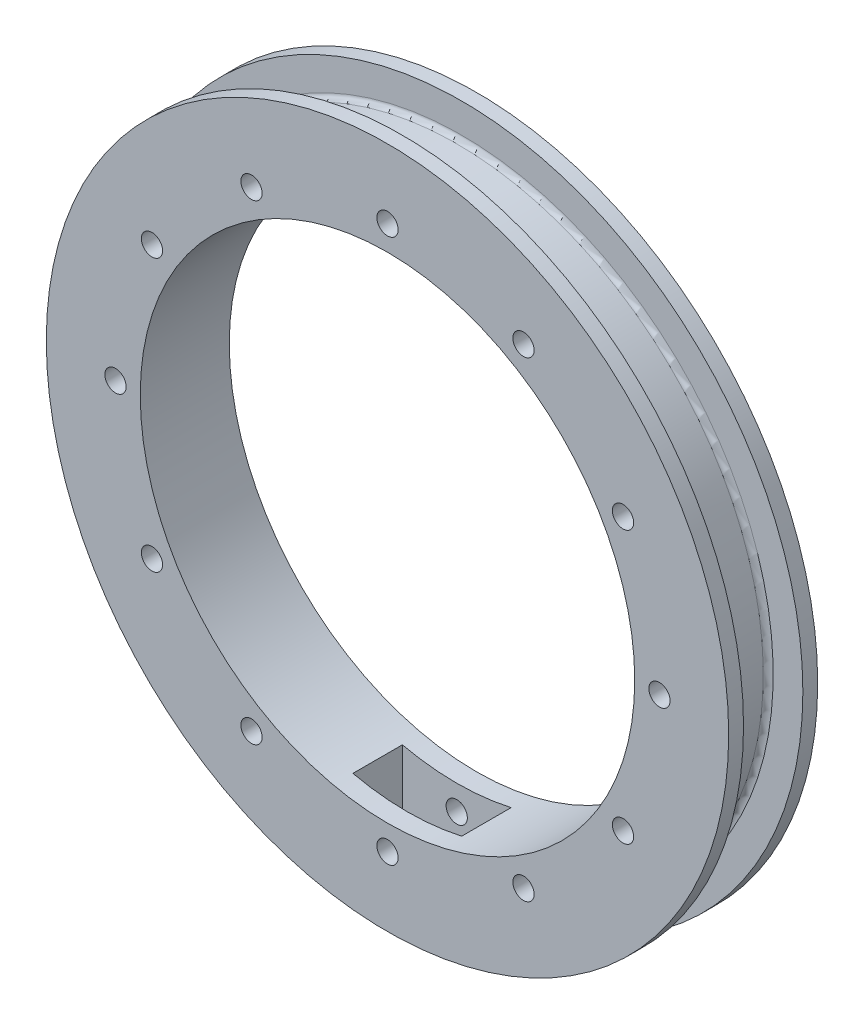
from build123d import *

# Parameters (mm, degrees)
SKETCH_1_R          = 62
EXTRUDE_1_DEPTH     = 6
SKETCH_2_R          = 69
EXTRUDE_2_DEPTH     = 3
EXTRUDE_START       = 3
SKETCH_3_R          = 69
EXTRUDE_3_DEPTH     = 3
FILLET_1_R          = 1
SKETCH_4_W          = 22
SKETCH_4_H          = 10
CUT_EXTRUDE_1_DEPTH = 133
SKETCH_5_R          = 50
CUT_EXTRUDE_2_DEPTH = 133
SKETCH_6_R          = 2.15
CUT_EXTRUDE_3_DEPTH = 133


with BuildPart() as part:
    # 草图1 → 凸台-拉伸1 (new, symmetric)
    with BuildSketch(Plane.XY):
        Circle(SKETCH_1_R)
    extrude(amount=EXTRUDE_1_DEPTH, both=True)

    # 草图2 → 凸台-拉伸2 (add)
    with BuildSketch(Plane(origin=(0, 0, -6), x_dir=(-1, 0, 0), z_dir=(0, 0, -1))):
        Circle(SKETCH_2_R)
    extrude(amount=EXTRUDE_2_DEPTH)

    # 草图3 → 凸台-拉伸3 (add)
    with BuildSketch(Plane.XY.offset(6).offset(EXTRUDE_START)):
        with Locations(Location((0, 0, 0), (0, 0, 180))):
            Circle(SKETCH_3_R)
    extrude(amount=-EXTRUDE_3_DEPTH)

    # 圆角1
    fillet_1_edges = [part.edges().sort_by_distance(p)[0] for p in [
        (-62, 0, 6),
        (-62, 0, -6),
    ]]
    fillet(fillet_1_edges, radius=FILLET_1_R)

    # 草图4 → 切除-拉伸1 (cut)
    with BuildSketch(Plane(origin=(0, 0, 0), x_dir=(1, 0, 0), z_dir=(0, 1, 0))):
        Rectangle(SKETCH_4_W, SKETCH_4_H)
    extrude(amount=-CUT_EXTRUDE_1_DEPTH, mode=Mode.SUBTRACT)

    # 草图5 → 切除-拉伸2 (cut)
    with BuildSketch(Plane(origin=(0, 0, -9), x_dir=(-1, 0, 0), z_dir=(0, 0, -1))):
        Circle(SKETCH_5_R)
    extrude(amount=-CUT_EXTRUDE_2_DEPTH, mode=Mode.SUBTRACT)

    # 草图6 → 切除-拉伸3 (cut)
    with BuildSketch(Plane(origin=(0, 0, -9), x_dir=(-1, 0, 0), z_dir=(0, 0, -1))):
        with Locations((0, 55)):
            Circle(SKETCH_6_R)
        with Locations((27.5, 47.631397208)):
            Circle(SKETCH_6_R)
        with Locations((47.631397208, 27.5)):
            Circle(SKETCH_6_R)
        with Locations((55, 0)):
            Circle(SKETCH_6_R)
        with Locations((47.631397208, -27.5)):
            Circle(SKETCH_6_R)
        with Locations((27.5, -47.631397208)):
            Circle(SKETCH_6_R)
        with Locations(Location((0, -55, 0), (0, 0, 180))):
            Circle(SKETCH_6_R)
        with Locations((-27.5, -47.631397208)):
            Circle(SKETCH_6_R)
        with Locations((-47.631397208, -27.5)):
            Circle(SKETCH_6_R)
        with Locations((-55, 0)):
            Circle(SKETCH_6_R)
        with Locations((-47.631397208, 27.5)):
            Circle(SKETCH_6_R)
        with Locations((-27.5, 47.631397208)):
            Circle(SKETCH_6_R)
    extrude(amount=-CUT_EXTRUDE_3_DEPTH, mode=Mode.SUBTRACT)


solid = part.part
